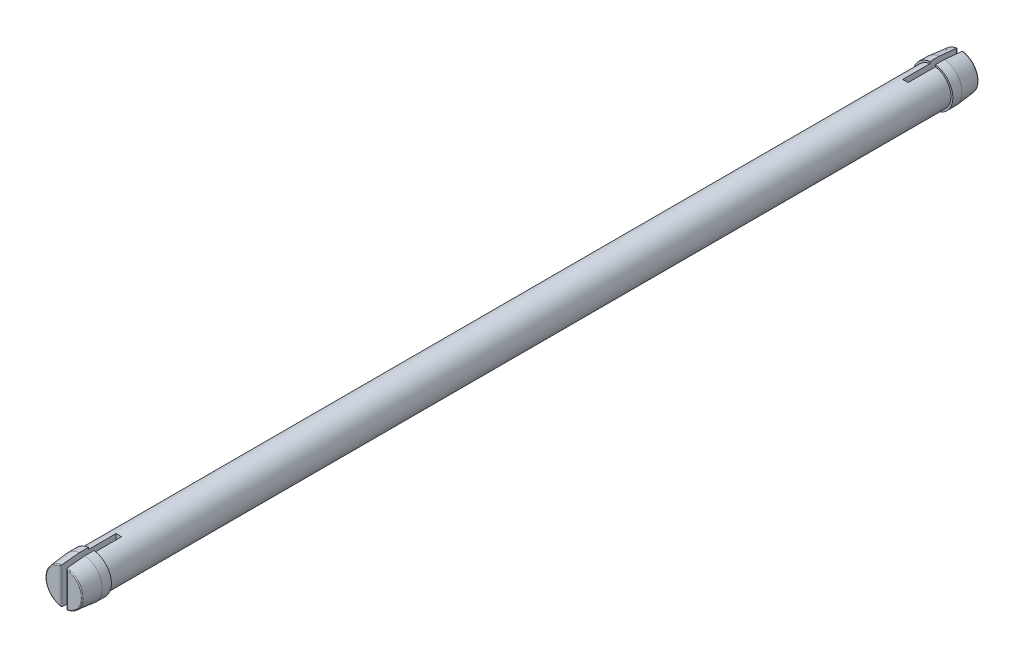
from build123d import *

# Parameters (mm, degrees)
SKETCH_1_R          = 2
EXTRUDE_1_DEPTH     = 98
SKETCH_4_W          = 0.6
SKETCH_4_H          = 4.591769547
CUT_EXTRUDE_1_DEPTH = 6
SKETCH_5_W          = 0.6
SKETCH_5_H          = 4.626337449
CUT_EXTRUDE_2_DEPTH = 6
FILLET_1_R          = 0.1


with BuildPart() as part:
    # 草图1 → 凸台-拉伸1 (new body)
    with BuildSketch(Plane.XY):
        Circle(SKETCH_1_R)
    extrude(amount=-EXTRUDE_1_DEPTH)

    # 草图2 → 旋转1 (revolve)
    with BuildSketch(Plane(origin=(0, 0, 0), x_dir=(1, 0, 0), z_dir=(0, 1, 0))):
        Polygon((2, 98), (2, 95), (2.2, 95), (2.2, 96), align=None)
    revolve(axis=Axis((0, 0, -98.400889699), (0, 0, 1)))

    # 草图3 → 旋转2 (revolve)
    with BuildSketch(Plane(origin=(0, 0, 0), x_dir=(1, 0, 0), z_dir=(0, 1, 0)), mode=Mode.PRIVATE) as revolve_2_sk:
        Polygon((2, 0), (2, 3), (2.2, 3), (2.2, 2), align=None)
    revolve(revolve_2_sk.sketch.rotate(Axis((0, 0, 0.764121939), (0, 0, -1)), 180), axis=Axis((0, 0, 0.764121939), (0, 0, -1)))

    # 草图4 → 切除-拉伸1 (cut)
    with BuildSketch(Plane.XY):
        with Locations((0, -0.031687242)):
            Rectangle(SKETCH_4_W, SKETCH_4_H)
    extrude(amount=-CUT_EXTRUDE_1_DEPTH, mode=Mode.SUBTRACT)

    # 草图5 → 切除-拉伸2 (cut)
    with BuildSketch(Plane(origin=(0, 0, -98), x_dir=(-1, 0, 0), z_dir=(0, 0, -1))):
        with Locations((0, -0.054732511)):
            Rectangle(SKETCH_5_W, SKETCH_5_H)
    extrude(amount=-CUT_EXTRUDE_2_DEPTH, mode=Mode.SUBTRACT)

    # 圆角1
    fillet_1_edges = [part.edges().sort_by_distance(p)[0] for p in [
        (0.3, 0, -98),
        (2, 0, -98),
        (-0.3, 0, -98),
        (-2, 0, -98),
        (-2, 0, 0),
        (-0.3, 0, 0),
        (2, 0, 0),
        (0.3, 0, 0),
    ]]
    fillet(fillet_1_edges, radius=FILLET_1_R)


solid = part.part
